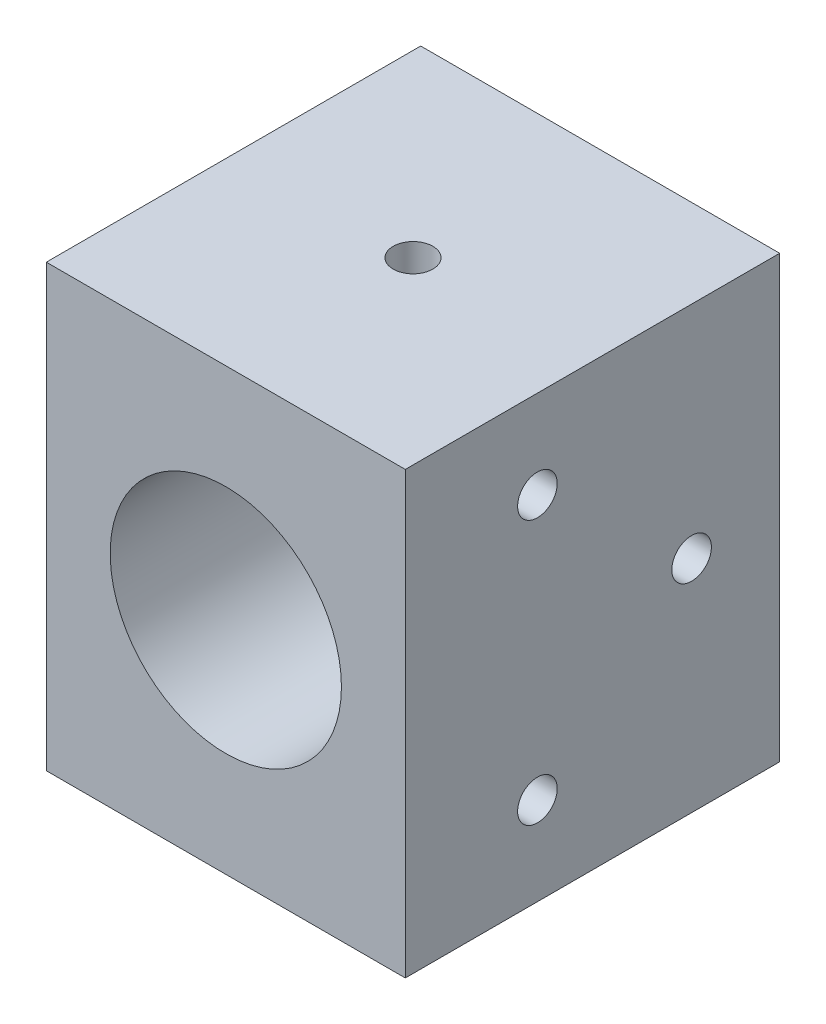
from build123d import *

# Parameters (mm, degrees)
SKETCH_1_W          = 16.3
SKETCH_1_H          = 20
SKETCH_1_R          = 5.25
EXTRUDE_1_DEPTH     = 10
SKETCH_1_6_W        = 16.3
SKETCH_1_6_H        = 20
EXTRUDE_2_DEPTH     = 2
SKETCH_2_R          = 0.9
CUT_EXTRUDE_1_DEPTH = 4
CUT_EXTRUDE_START   = -12.3
SKETCH_2_2_R        = 0.9
CUT_EXTRUDE_2_DEPTH = 4
SKETCH_3_W          = 5
SKETCH_3_H          = 20
EXTRUDE_3_DEPTH     = 16.3
SKETCH_5_R          = 0.9
CUT_EXTRUDE_3_DEPTH = 22.579851714
SKETCH_6_R          = 0.9
CUT_EXTRUDE_4_DEPTH = 4
CUT_EXTRUDE_START_2 = -16
SKETCH_6_3_R        = 0.9
CUT_EXTRUDE_5_DEPTH = 4


with BuildPart() as part:
    # 草图1 → 凸台-拉伸1 (new body)
    with BuildSketch(Plane.XY):
        Rectangle(SKETCH_1_W, SKETCH_1_H)
        Circle(SKETCH_1_R, mode=Mode.SUBTRACT)
    extrude(amount=EXTRUDE_1_DEPTH)

    # 草图1<6> → 凸台-拉伸2 (add)
    with BuildSketch(Plane.XY):
        Rectangle(SKETCH_1_6_W, SKETCH_1_6_H)
    extrude(amount=-EXTRUDE_2_DEPTH)

    # 草图2 → 切除-拉伸1 (cut)
    with BuildSketch(Plane.ZY.offset(8.15)):
        with Locations(Location((4, 6, 0), (0, 0, 270))):
            Circle(SKETCH_2_R)
        with Locations(Location((4, -6, 0), (0, 0, 270))):
            Circle(SKETCH_2_R)
    extrude(amount=-CUT_EXTRUDE_1_DEPTH, mode=Mode.SUBTRACT)

    # 草图2<2> → 切除-拉伸2 (cut)
    with BuildSketch(Plane.ZY.offset(8.15).offset(CUT_EXTRUDE_START)):
        with Locations(Location((4, 6, 0), (0, 0, 270))):
            Circle(SKETCH_2_2_R)
        with Locations(Location((4, -6, 0), (0, 0, 270))):
            Circle(SKETCH_2_2_R)
    extrude(amount=-CUT_EXTRUDE_2_DEPTH, mode=Mode.SUBTRACT)

    # 草图3 → 凸台-拉伸3 (add)
    with BuildSketch(Plane(origin=(8.15, 0, 0), x_dir=(0, 0, -1), z_dir=(1, 0, 0))):
        with Locations((4.5, 0)):
            Rectangle(SKETCH_3_W, SKETCH_3_H)
    extrude(amount=-EXTRUDE_3_DEPTH)

    # 草图5 → 切除-拉伸3 (cut, through all)
    with BuildSketch(Plane.ZY.offset(8.15)):
        with Locations(Location((-3, 0, 0), (0, 0, 270))):
            Circle(SKETCH_5_R)
    extrude(amount=-CUT_EXTRUDE_3_DEPTH, mode=Mode.SUBTRACT)

    # 草图6 → 切除-拉伸4 (cut)
    with BuildSketch(Plane.XZ.offset(10)):
        with Locations(Location((0, 1.5, 0), (0, 0, 270))):
            Circle(SKETCH_6_R)
    extrude(amount=-CUT_EXTRUDE_4_DEPTH, mode=Mode.SUBTRACT)

    # 草图6<3> → 切除-拉伸5 (cut)
    with BuildSketch(Plane.XZ.offset(10).offset(CUT_EXTRUDE_START_2)):
        with Locations(Location((0, 1.5, 0), (0, 0, 270))):
            Circle(SKETCH_6_3_R)
    extrude(amount=-CUT_EXTRUDE_5_DEPTH, mode=Mode.SUBTRACT)


solid = part.part
